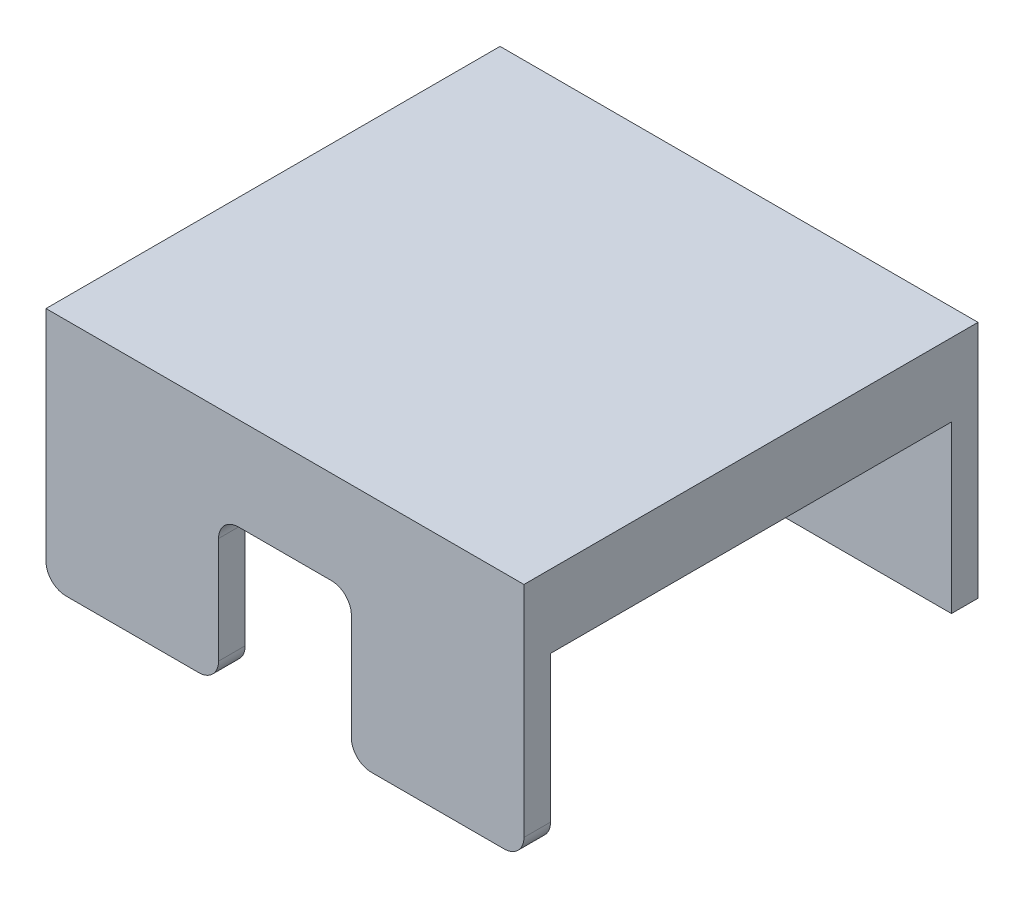
from build123d import *

# Parameters (mm, degrees)
SKETCH1_W           = 360
SKETCH1_H           = 342
BOSS_EXTRUDE1_DEPTH = 55
BOSS_EXTRUDE2_DEPTH = 20
SKETCH4_R           = 4
CUT_EXTRUDE2_DEPTH  = 10
FILLET1_R           = 15


with BuildPart() as part:
    # Sketch1 → Boss-Extrude1 (new body)
    with BuildSketch(Plane(origin=(0, 0, 0), x_dir=(1, 0, 0), z_dir=(0, 1, 0))):
        Rectangle(SKETCH1_W, SKETCH1_H)
    extrude(amount=BOSS_EXTRUDE1_DEPTH)

    # Sketch2 → Boss-Extrude2 (add)
    with BuildSketch(Plane.XY.offset(171)):
        Polygon((180, 0), (0, 0), (0, -15), (50, -15), (50, -125), (180, -125), align=None)
        Polygon((0, 0), (-180, 0), (-180, -125), (-50, -125), (-50, -15), (0, -15), align=None)
    boss_extrude2 = extrude(amount=-BOSS_EXTRUDE2_DEPTH)

    # Sketch4 → Cut-Extrude2 (cut)
    with BuildSketch(Plane.XY.offset(151)):
        with Locations((105, -65)):
            Circle(SKETCH4_R)
        with Locations(Location((-105, -65, 0), (0, 0, 180))):
            Circle(SKETCH4_R)
    cut_extrude2 = extrude(amount=CUT_EXTRUDE2_DEPTH, mode=Mode.SUBTRACT)

    # Fillet1
    fillet1_edges = [part.edges().sort_by_distance(p)[0] for p in [
        (180, -125, 161),
        (50, -125, 161),
        (50, -15, 161),
        (-50, -15, 161),
        (-50, -125, 161),
        (-180, -125, 161),
    ]]
    fillet(fillet1_edges, radius=FILLET1_R)

    # Mirror1: Boss-Extrude2, Cut-Extrude2 across plane
    add(boss_extrude2.mirror(Plane.XY))
    add(cut_extrude2.mirror(Plane.XY), mode=Mode.SUBTRACT)


solid = part.part
